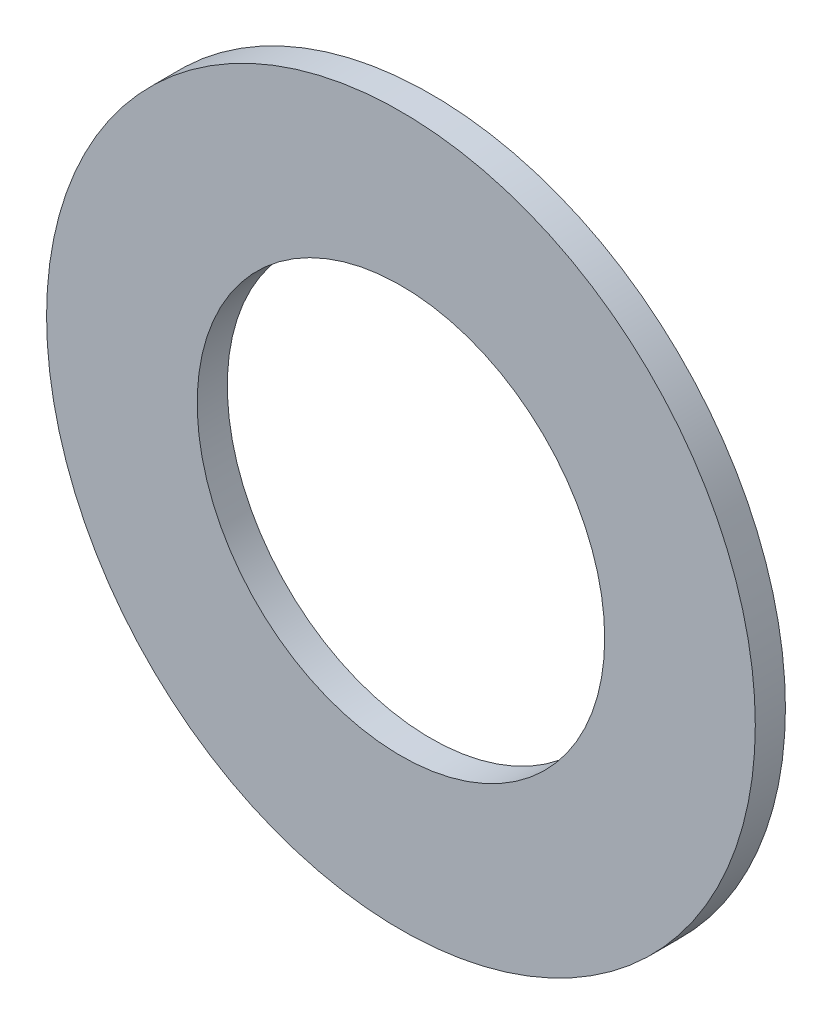
from build123d import *

# Parameters (mm, degrees)
SKETCH1_R           = 20
SKETCH1_R_2         = 11.5
BOSS_EXTRUDE1_DEPTH = 1.7


with BuildPart() as part:
    # Sketch1 → Boss-Extrude1 (new body)
    with BuildSketch(Plane.XY):
        Circle(SKETCH1_R)
        Circle(SKETCH1_R_2, mode=Mode.SUBTRACT)
    extrude(amount=BOSS_EXTRUDE1_DEPTH)


solid = part.part
